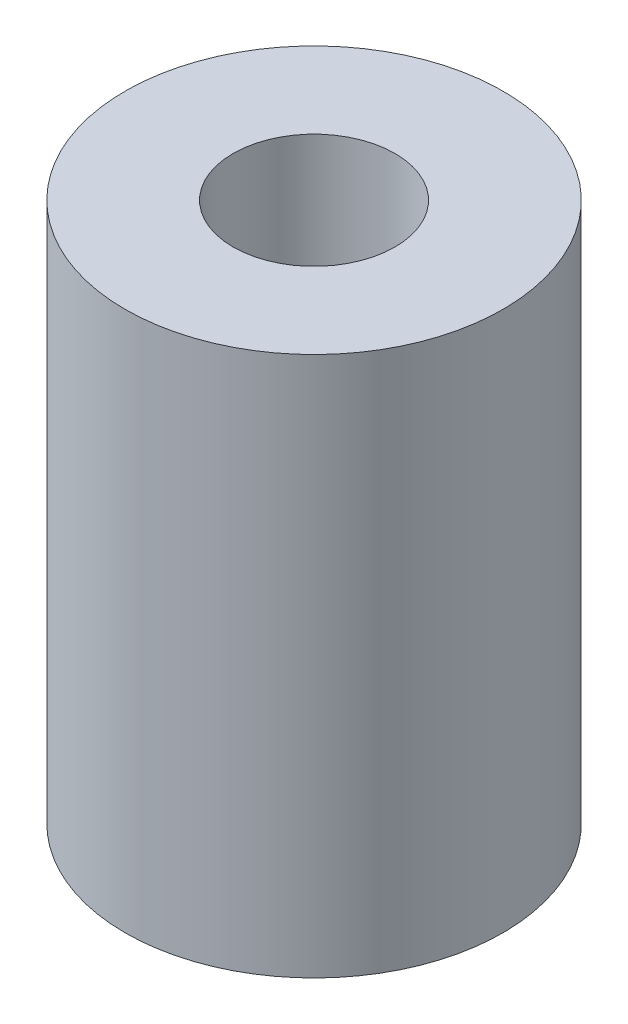
from build123d import *

# Parameters (mm, degrees)
SKETCH1_R           = 3.5
SKETCH1_R_2         = 1.5
BOSS_EXTRUDE1_DEPTH = 10


with BuildPart() as part:
    # Sketch1 → Boss-Extrude1 (new body)
    with BuildSketch(Plane(origin=(0, 0, 0), x_dir=(1, 0, 0), z_dir=(0, 1, 0))):
        with Locations(Location((0, 0, 0), (0, 0, 270))):
            Circle(SKETCH1_R)
        with Locations(Location((0, 0, 0), (0, 0, 270))):
            Circle(SKETCH1_R_2, mode=Mode.SUBTRACT)
    extrude(amount=BOSS_EXTRUDE1_DEPTH)


solid = part.part
